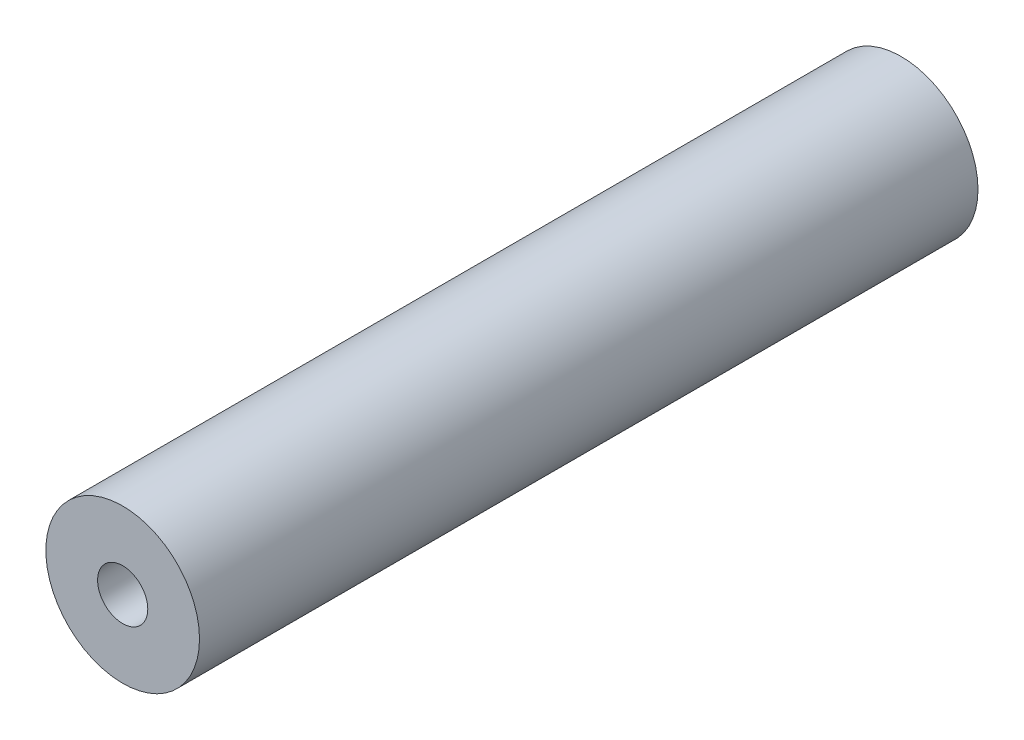
from build123d import *

# Parameters (mm, degrees)
SKETCH_1_R      = 15
SKETCH_1_R_2    = 4.9
EXTRUDE_1_DEPTH = 152


with BuildPart() as part:
    # 草圖1 → 填料-伸長1 (new body)
    with BuildSketch(Plane.XY):
        Circle(SKETCH_1_R)
        Circle(SKETCH_1_R_2, mode=Mode.SUBTRACT)
    extrude(amount=EXTRUDE_1_DEPTH)


solid = part.part
